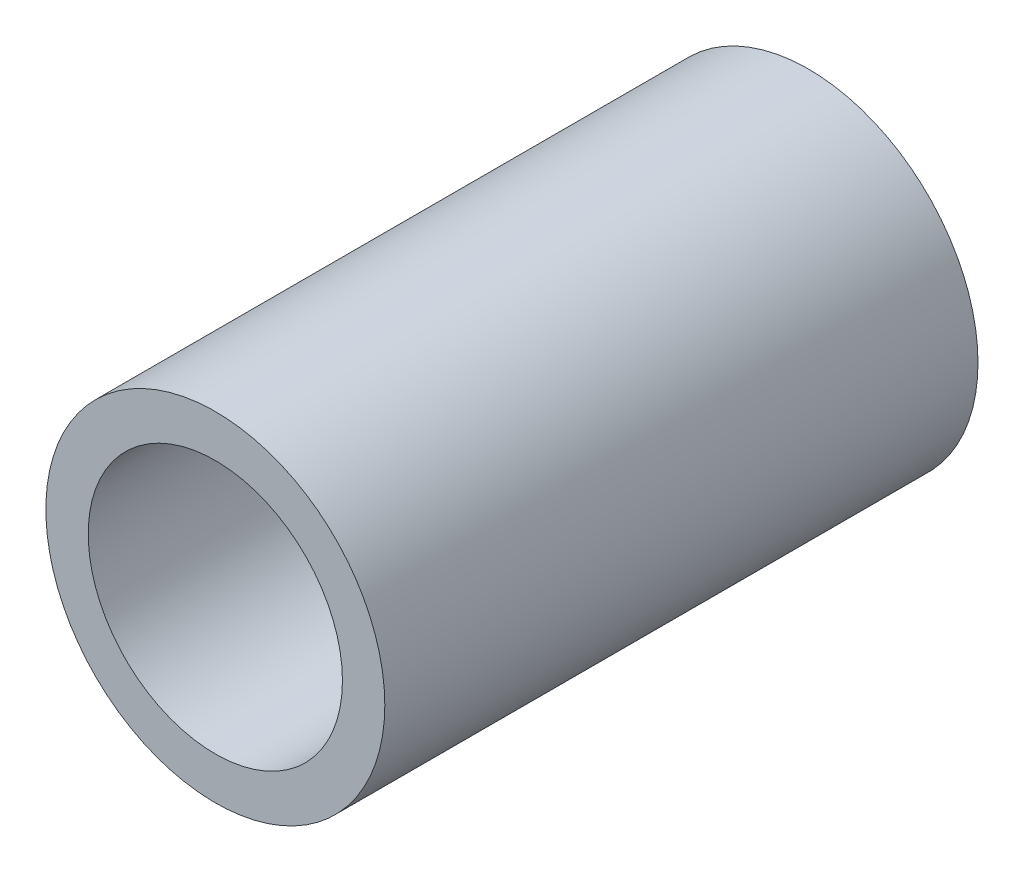
from build123d import *

# Parameters (mm, degrees)
SKETCH1_R      = 6.35
SKETCH1_R_2    = 4.7625
EXTRUDE1_DEPTH = 11.1125


with BuildPart() as part:
    # Sketch1 → Extrude1 (new, symmetric)
    with BuildSketch(Plane.XY):
        Circle(SKETCH1_R)
        Circle(SKETCH1_R_2, mode=Mode.SUBTRACT)
    extrude(amount=EXTRUDE1_DEPTH, both=True)


solid = part.part
